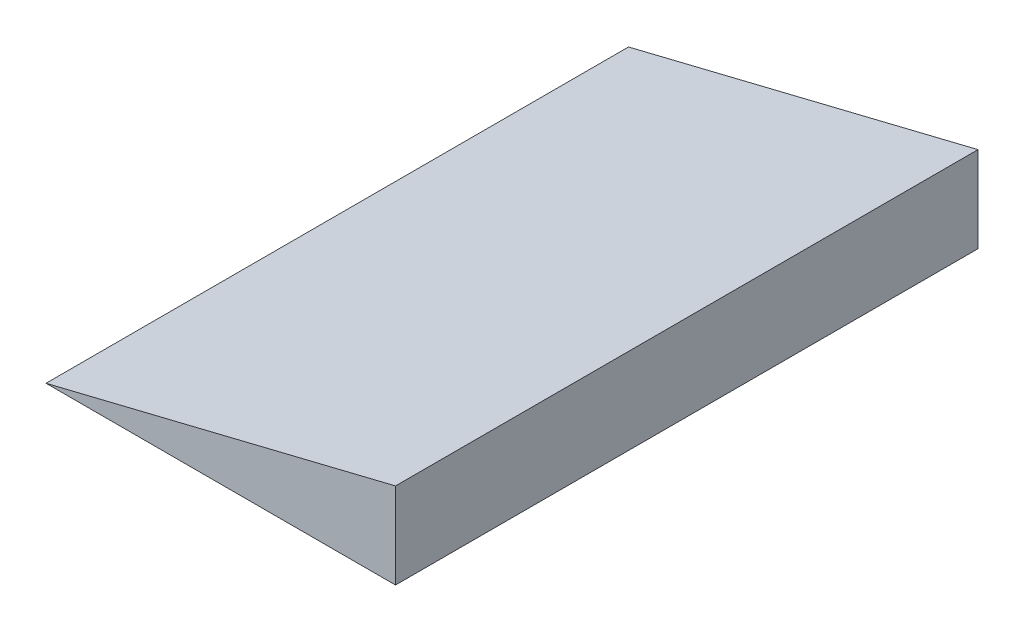
from build123d import *

# Parameters (mm, degrees)
BOSS_EXTRUDE1_DEPTH = 50


with BuildPart() as part:
    # Sketch1 → Boss-Extrude1 (new body)
    with BuildSketch(Plane.XY):
        Polygon((0, 0), (30, 0), (30, 7.368706754), align=None)
    extrude(amount=BOSS_EXTRUDE1_DEPTH)


solid = part.part
